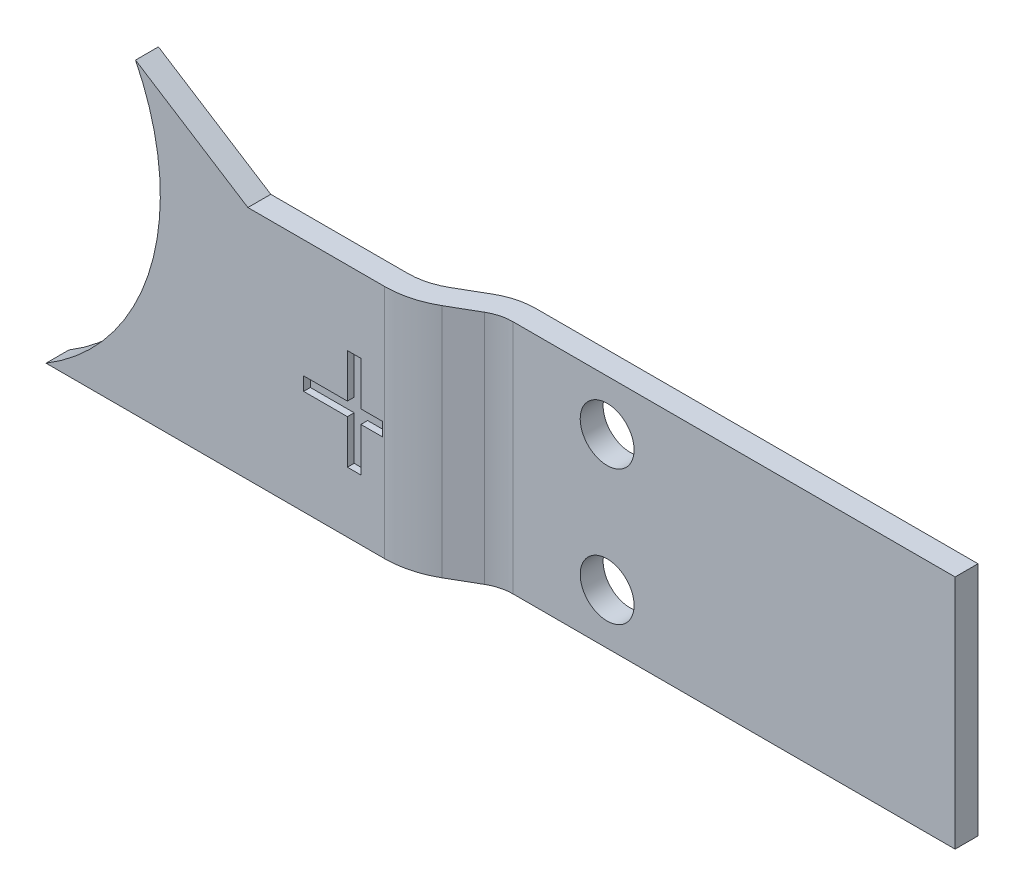
from build123d import *

# Parameters (mm, degrees)
BOSS_EXTRUDE1_DEPTH = 3.4
SKETCH3_R           = 5
CUT_EXTRUDE1_DEPTH  = 6
CUT_EXTRUDE2_DEPTH  = 10
SKETCH6_R           = 35
CUT_EXTRUDE3_DEPTH  = 10
CUT_EXTRUDE4_DEPTH  = 1
CUT_EXTRUDE5_REACH  = 87.508
SKETCH8_W           = 12
SKETCH8_H           = 35
BOSS_EXTRUDE2_DEPTH = 35
SKETCH10_R          = 4
CUT_EXTRUDE6_DEPTH  = 10


with BuildPart() as part:
    # Sketch1 → Boss-Extrude1 (new body)
    with BuildSketch(Plane.XY):
        with BuildLine():
            Line((0, -30), (80, -30))
            Line((80, -30), (80, 5))
            Line((80, 5), (48, 5))
            Line((48, 5), (16.114075804, 25.304872277))
            ThreePointArc((16.114075804, 25.304872277), (-28.802310396, 8.392074585), (0, -30))
        make_face()
    extrude(amount=BOSS_EXTRUDE1_DEPTH)

    # Sketch3 → Cut-Extrude1 (cut)
    with BuildSketch(Plane.XY.offset(3.4)):
        Circle(SKETCH3_R)
    extrude(amount=-CUT_EXTRUDE1_DEPTH, mode=Mode.SUBTRACT)

    # Sketch5 → Cut-Extrude2 (cut)
    with BuildSketch(Plane.XY.offset(3.4)):
        with BuildLine():
            ThreePointArc((0, 10), (-8.660254038, 5), (-8.660254038, -5))
            ThreePointArc((-8.660254038, -5), (-10.124355653, -10.464101615), (-15.588457268, -9))
            ThreePointArc((-15.588457268, -9), (-15.588457268, 9), (0, 18))
            ThreePointArc((0, 18), (4, 14), (0, 10))
        make_face()
    extrude(amount=-CUT_EXTRUDE2_DEPTH, mode=Mode.SUBTRACT)

    # Sketch6 → Cut-Extrude3 (cut)
    with BuildSketch(Plane(origin=(0, 0, 0), x_dir=(-1, 0, 0), z_dir=(0, 0, -1))):
        Circle(SKETCH6_R)
    extrude(amount=-CUT_EXTRUDE3_DEPTH, mode=Mode.SUBTRACT)

    # Sketch7 → Cut-Extrude4 (cut)
    with BuildSketch(Plane.XY.offset(3.4)):
        Polygon((62.77538264, -14.5), (62.77538264, -21), (64.77538264, -21), (64.77538264, -14.5), (71.27538264, -14.5), (71.27538264, -12.5), (64.77538264, -12.5), (64.77538264, -6), (62.77538264, -6), (62.77538264, -12.5), (56.27538264, -12.5), (56.27538264, -14.5), align=None)
    extrude(amount=-CUT_EXTRUDE4_DEPTH, mode=Mode.SUBTRACT)

    # Sketch8 → Cut-Extrude5 (cut, up to next)
    with BuildSketch(Plane(origin=(0, 0, 0), x_dir=(-1, 0, 0), z_dir=(0, 0, -1)), mode=Mode.PRIVATE) as cut_extrude5_sk1:
        with Locations((-74, -12.5)):
            Rectangle(SKETCH8_W, SKETCH8_H)
    cut_extrude5_tool1 = extrude(cut_extrude5_sk1.sketch, amount=-CUT_EXTRUDE5_REACH, mode=Mode.PRIVATE) & part.part
    add(cut_extrude5_tool1.solids().sort_by_distance((74, -12.5, 0))[0], mode=Mode.SUBTRACT)

    # Sketch9 → Boss-Extrude2 (add)
    with BuildSketch(Plane(origin=(0, 5, 0), x_dir=(1, 0, 0), z_dir=(0, 1, 0))):
        with BuildLine():
            Line((68, 0), (68.320508076, 0))
            ThreePointArc((68.320508076, 0), (70.908698527, 0.340741737), (73.320508076, 1.339745962))
            Line((73.320508076, 1.339745962), (77.339745962, 3.660254038))
            ThreePointArc((77.339745962, 3.660254038), (79.751555511, 4.659258263), (82.339745962, 5))
            Line((82.339745962, 5), (83, 5))
            Line((83, 5), (148, 5))
            Line((148, 5), (148, 1.6))
            Line((148, 1.6), (83, 1.6))
            Line((83, 1.6), (82.339745962, 1.6))
            ThreePointArc((82.339745962, 1.6), (80.631540264, 1.375110454), (79.039745962, 0.715767665))
            Line((79.039745962, 0.715767665), (75.020508076, -1.604740411))
            ThreePointArc((75.020508076, -1.604740411), (71.78868328, -2.943406072), (68.320508076, -3.4))
            Line((68.320508076, -3.4), (68, -3.4))
            Line((68, -3.4), (68, 0))
        make_face()
    extrude(amount=-BOSS_EXTRUDE2_DEPTH)

    # Sketch10 → Cut-Extrude6 (cut)
    with BuildSketch(Plane(origin=(0, 0, -5), x_dir=(-1, 0, 0), z_dir=(0, 0, -1))):
        with Locations((-96.339745962, -2.5)):
            Circle(SKETCH10_R)
        with Locations(Location((-96.339745962, -22.5, 0), (0, 0, 180))):
            Circle(SKETCH10_R)
    extrude(amount=-CUT_EXTRUDE6_DEPTH, mode=Mode.SUBTRACT)


solid = part.part
